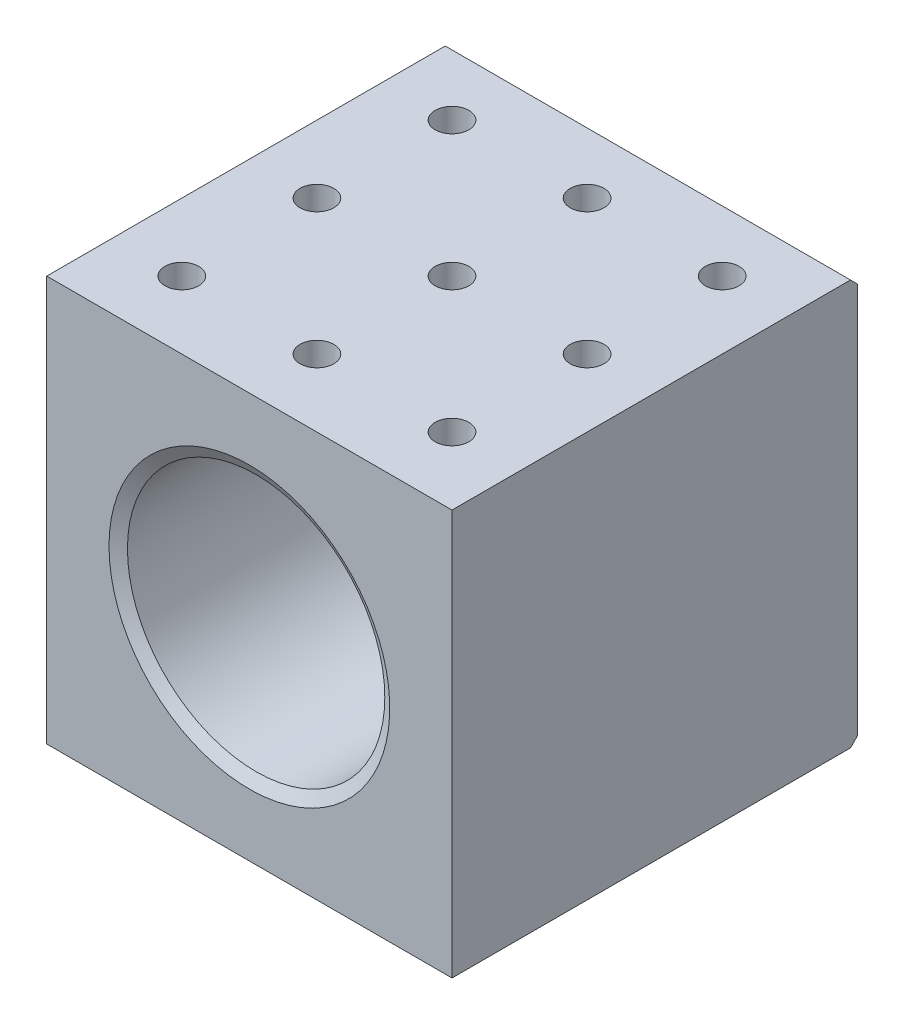
from build123d import *
from OCP.BRepFilletAPI import BRepFilletAPI_MakeChamfer

# Parameters (mm, degrees)
SKETCH1_W                 = 30
SKETCH1_H                 = 30
SKETCH1_R                 = 9.525
BOSS_EXTRUDE1_DEPTH       = 15
CHAMFER2_SIZE             = 0.5
CHAMFER2_SIZE2            = 0.866025404
CHAMFER3_SIZE             = 0.5
M3X0_5_TAPPED_HOLE1_D     = 2.5
M3X0_5_TAPPED_HOLE1_DEPTH = 6
M3X0_5_TAPPED_HOLE1_TIP   = 0.751075774


with BuildPart() as part:
    # Sketch1 → Boss-Extrude1 (new, symmetric)
    with BuildSketch(Plane.XY):
        Rectangle(SKETCH1_W, SKETCH1_H)
        Circle(SKETCH1_R, mode=Mode.SUBTRACT)
    extrude(amount=BOSS_EXTRUDE1_DEPTH, both=True)

    # Chamfer2: one chamfer whose edges measure the first distance from different faces: ONE call of the kernel's chamfer builder (chamfer() names one face for all edges)
    chamfer2_edges_1 = [part.edges().sort_by_distance(p)[0] for p in [
        (-9.525, 0, -15),
    ]]
    chamfer2_side_1 = [part.faces().sort_by_distance(p)[0] for p in [
        (0, -14.575735931, -15),
    ]]
    chamfer2_edges_2 = [part.edges().sort_by_distance(p)[0] for p in [
        (-9.525, 0, 15),
    ]]
    chamfer2_side_2 = [part.faces().sort_by_distance(p)[0] for p in [
        (-9.525, 0, 0),
    ]]
    chamfer2 = BRepFilletAPI_MakeChamfer(part.part.solid().wrapped)
    for e in chamfer2_edges_1:
        chamfer2.Add(CHAMFER2_SIZE, CHAMFER2_SIZE2, e.wrapped, chamfer2_side_1[0].wrapped)  # the first distance lies on this face
    for e in chamfer2_edges_2:
        chamfer2.Add(CHAMFER2_SIZE, CHAMFER2_SIZE2, e.wrapped, chamfer2_side_2[0].wrapped)  # the first distance lies on this face
    add(Compound.cast(chamfer2.Shape()), mode=Mode.REPLACE)

    # Chamfer3
    chamfer3_edges = [part.edges().sort_by_distance(p)[0] for p in [
        (0, 15, -15),
        (0, -15, -15),
    ]]
    chamfer(chamfer3_edges, length=CHAMFER3_SIZE)

    # M3x0.5 Tapped Hole1
    with Locations(Plane(origin=(0, 15, 0), x_dir=(1, 0, 0), z_dir=(0, 1, 0))):
        with Locations((-10, 0), (10, 0), (0, 0), (-10, 10), (-10, -10), (10, 10), (10, -10), (0, 10), (0, -10)):
            Hole(M3X0_5_TAPPED_HOLE1_D / 2, depth=M3X0_5_TAPPED_HOLE1_DEPTH)
            with Locations((0, 0, -(M3X0_5_TAPPED_HOLE1_DEPTH + M3X0_5_TAPPED_HOLE1_TIP / 2))):  # 118° drill point
                Cone(0, M3X0_5_TAPPED_HOLE1_D / 2, M3X0_5_TAPPED_HOLE1_TIP, mode=Mode.SUBTRACT)


solid = part.part
